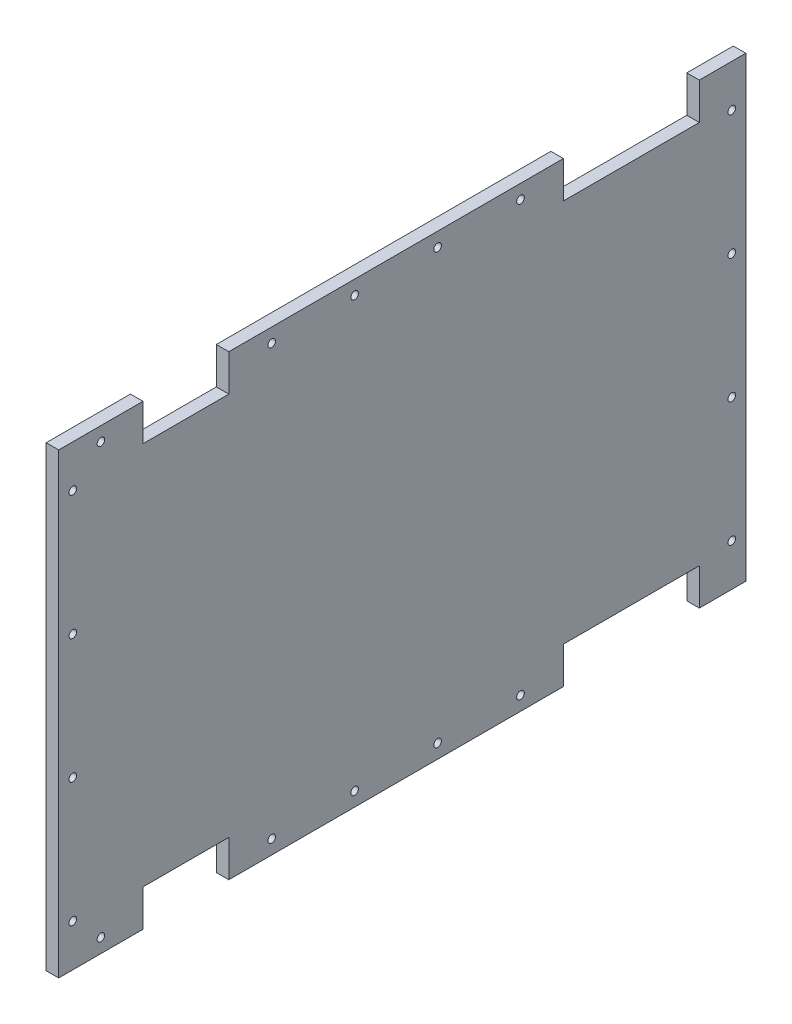
from build123d import *

# Parameters (mm, degrees)
SKETCH1_W           = 610
SKETCH1_H           = 406
BOSS_EXTRUDE1_DEPTH = 11.1125
SKETCH3_W           = 120.65
SKETCH3_H           = 32.62
CUT_EXTRUDE2_DEPTH  = 367.548070048
SKETCH8_W           = 76.2
SKETCH8_H           = 32.62
CUT_EXTRUDE3_DEPTH  = 367.548070048
SKETCH4_R           = 3.3782
CUT_EXTRUDE4_DEPTH  = 367.548070048


with BuildPart() as part:
    # Sketch1 → Boss-Extrude1 (new body)
    with BuildSketch(Plane(origin=(0, 0, 0), x_dir=(0, 0, -1), z_dir=(1, 0, 0))):
        Rectangle(SKETCH1_W, SKETCH1_H)
    extrude(amount=BOSS_EXTRUDE1_DEPTH)

    # Sketch3 → Cut-Extrude2 (cut, through all)
    with BuildSketch(Plane(origin=(11.1125, 0, 0), x_dir=(0, 0, -1), z_dir=(1, 0, 0))):
        with Locations((203.4, 186.69)):
            Rectangle(SKETCH3_W, SKETCH3_H)
    cut_extrude2 = extrude(amount=-CUT_EXTRUDE2_DEPTH, mode=Mode.SUBTRACT)

    # Sketch8 → Cut-Extrude3 (cut, through all)
    with BuildSketch(Plane(origin=(11.1125, 0, 0), x_dir=(0, 0, -1), z_dir=(1, 0, 0))):
        with Locations((-192.086299996, 186.69)):
            Rectangle(SKETCH8_W, SKETCH8_H)
    cut_extrude3 = extrude(amount=-CUT_EXTRUDE3_DEPTH, mode=Mode.SUBTRACT)

    # Mirror3: Cut-Extrude2, Cut-Extrude3 across plane
    add(cut_extrude2.mirror(Plane.ZX), mode=Mode.SUBTRACT)
    add(cut_extrude3.mirror(Plane.ZX), mode=Mode.SUBTRACT)

    # Sketch4 → Cut-Extrude4 (cut, through all)
    with BuildSketch(Plane(origin=(11.1125, 0, 0), x_dir=(0, 0, -1), z_dir=(1, 0, 0))):
        with Locations(Location((-292.5, 165.50000007, 0), (0, 0, 90))):
            Circle(SKETCH4_R)
        with Locations(Location((-292.5, 55.16666669, 0), (0, 0, 90))):
            Circle(SKETCH4_R)
        with Locations(Location((-292.5, -55.16666669, 0), (0, 0, 90))):
            Circle(SKETCH4_R)
        with Locations(Location((-292.5, -165.50000007, 0), (0, 0, 90))):
            Circle(SKETCH4_R)
        with Locations(Location((292.5, -165.50000007, 0), (0, 0, 270))):
            Circle(SKETCH4_R)
        with Locations(Location((292.5, -55.16666669, 0), (0, 0, 270))):
            Circle(SKETCH4_R)
        with Locations(Location((292.5, 165.50000007, 0), (0, 0, 270))):
            Circle(SKETCH4_R)
        with Locations(Location((292.5, 55.16666669, 0), (0, 0, 270))):
            Circle(SKETCH4_R)
        with Locations(Location((-267.50000007, 190.5, 0), (0, 0, 90))):
            Circle(SKETCH4_R)
        with Locations(Location((-115.886299996, 190.5, 0), (0, 0, 90))):
            Circle(SKETCH4_R)
        with Locations(Location((-42.265866664, 190.5, 0), (0, 0, 90))):
            Circle(SKETCH4_R)
        with Locations(Location((31.354566668, 190.5, 0), (0, 0, 90))):
            Circle(SKETCH4_R)
        with Locations(Location((104.975, 190.5, 0), (0, 0, 90))):
            Circle(SKETCH4_R)
        with Locations(Location((104.975, -190.5, 0), (0, 0, 270))):
            Circle(SKETCH4_R)
        with Locations(Location((31.354566668, -190.5, 0), (0, 0, 270))):
            Circle(SKETCH4_R)
        with Locations(Location((-42.265866664, -190.5, 0), (0, 0, 270))):
            Circle(SKETCH4_R)
        with Locations(Location((-115.886299996, -190.5, 0), (0, 0, 270))):
            Circle(SKETCH4_R)
        with Locations(Location((-267.50000007, -190.5, 0), (0, 0, 270))):
            Circle(SKETCH4_R)
    extrude(amount=-CUT_EXTRUDE4_DEPTH, mode=Mode.SUBTRACT)


solid = part.part
